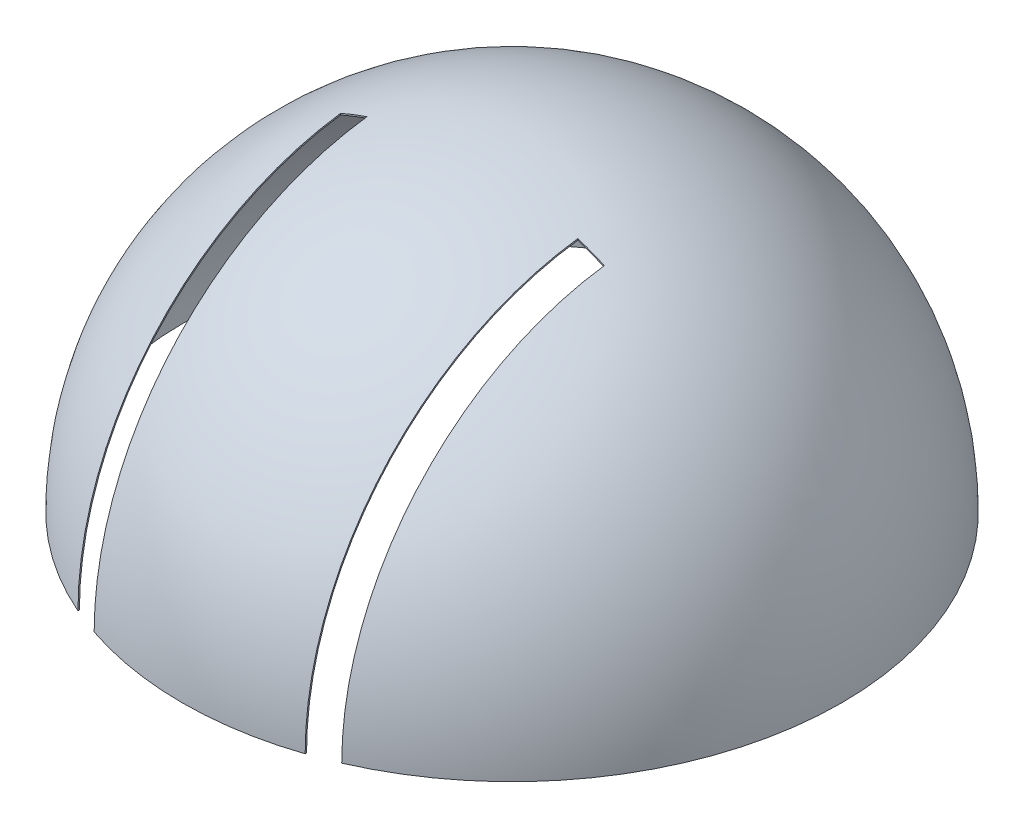
from build123d import *

# Parameters (mm, degrees)
REVOLVE_1_ANGLE     = 180
SHELL_1_T           = -1
SKETCH_2_W          = 20
SKETCH_2_H          = 220
CUT_EXTRUDE_1_DEPTH = 434.012701892


with BuildPart() as part:
    # Эскиз1 → Повернуть1 (revolve)
    with BuildSketch(Plane(origin=(0, 0, 0), x_dir=(1, 0, 0), z_dir=(0, 1, 0))):
        with BuildLine():
            Line((-250, 0), (250, 0))
            ThreePointArc((250, 0), (0, 250), (-250, 0))
        make_face()
    revolve(axis=Axis((-250, 0, 0), (1, 0, 0)), revolution_arc=REVOLVE_1_ANGLE)

    # Оболочка1
    shell_1_openings = [part.faces().sort_by_distance(p)[0] for p in [
        (0, 0, 0),
    ]]
    offset(amount=SHELL_1_T, openings=shell_1_openings)

    # Эскиз2 → Вырез-Вытянуть1 (cut, through all)
    with BuildSketch(Plane(origin=(0, 0, 0), x_dir=(1, 0, 0), z_dir=(0, 1, 0))):
        with Locations((-90, -140)):
            Rectangle(SKETCH_2_W, SKETCH_2_H)
        with Locations((90, -140)):
            Rectangle(SKETCH_2_W, SKETCH_2_H)
    extrude(amount=CUT_EXTRUDE_1_DEPTH, mode=Mode.SUBTRACT)


solid = part.part
